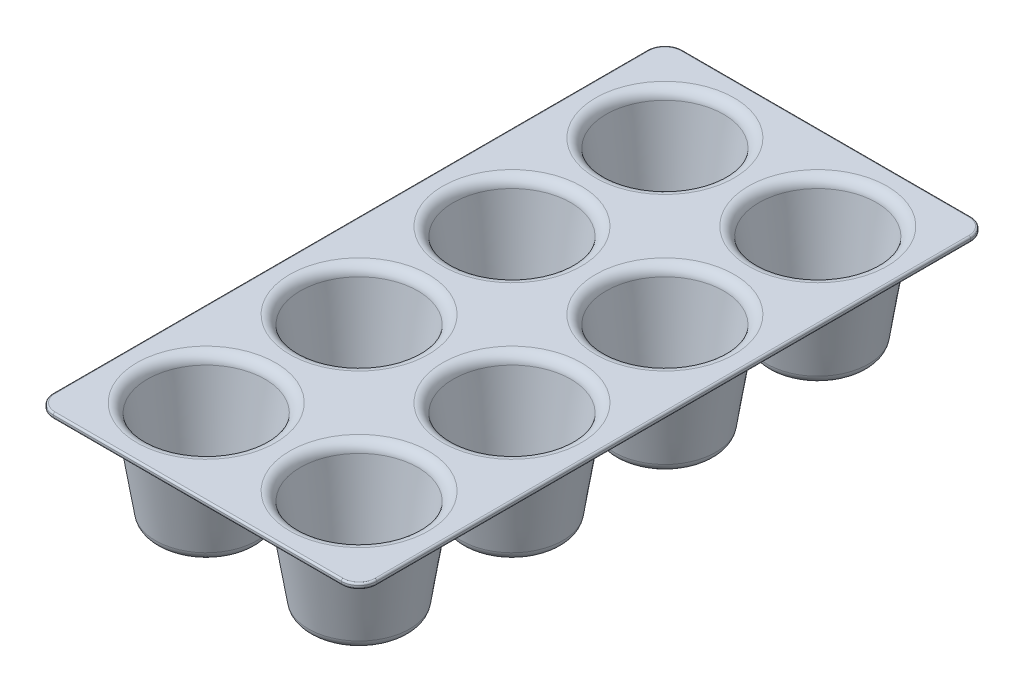
from build123d import *

# Parameters (mm, degrees)
LPATTERN5_COUNT     = 4
LPATTERN5_PITCH     = 86
LPATTERN6_COUNT     = 2
LPATTERN6_PITCH     = 86
SKETCH6_R           = 39
BOSS_EXTRUDE2_DEPTH = 3
FILLET1_R           = 1
FILLET2_R           = 1


with BuildPart() as part:
    # Sketch1 → Revolve1 (revolve)
    with BuildSketch(Plane.XY):
        with BuildLine():
            Line((0, -33.192951346), (-22.602129613, -33.192951346))
            ThreePointArc((-22.602129613, -33.192951346), (-26.498817903, -31.755387139), (-28.528259657, -28.131558136))
            Line((-28.528259657, -28.131558136), (-36.036934978, 19.276352049))
            ThreePointArc((-36.036934978, 19.276352049), (-37.051655855, 21.088266551), (-39, 21.807048654))
            Line((-39, 21.807048654), (-39, 24.807048654))
            ThreePointArc((-39, 24.807048654), (-35.10331171, 23.369484448), (-33.073869956, 19.745655445))
            Line((-33.073869956, 19.745655445), (-25.565194635, -27.662254741))
            ThreePointArc((-25.565194635, -27.662254741), (-24.550473758, -29.474169243), (-22.602129613, -30.192951346))
            Line((-22.602129613, -30.192951346), (0, -30.192951346))
            Line((0, -30.192951346), (0, -33.192951346))
        make_face()
    revolve(axis=Axis((0, 5.813808691, 0), (0, -1, 0)))


with BuildPart() as lpattern5_1:
    # LPattern5: pattern copy
    add(part.part.moved(Location(Vector(0, 0, 1) * (1 * LPATTERN5_PITCH))))


with BuildPart() as lpattern5_2:
    # LPattern5: pattern copy
    add(part.part.moved(Location(Vector(0, 0, 1) * (2 * LPATTERN5_PITCH))))


with BuildPart() as lpattern5_3:
    # LPattern5: pattern copy
    add(part.part.moved(Location(Vector(0, 0, 1) * (3 * LPATTERN5_PITCH))))


with BuildPart() as lpattern6_1:
    # LPattern6: pattern copy
    add(lpattern5_3.part.moved(Location(Vector(-1, 0, 0) * (1 * LPATTERN6_PITCH))))


with BuildPart() as lpattern6_2:
    # LPattern6: pattern copy
    add(lpattern5_2.part.moved(Location(Vector(-1, 0, 0) * (1 * LPATTERN6_PITCH))))


with BuildPart() as lpattern6_3:
    # LPattern6: pattern copy
    add(lpattern5_1.part.moved(Location(Vector(-1, 0, 0) * (1 * LPATTERN6_PITCH))))


with BuildPart() as lpattern6_4:
    # LPattern6: pattern copy
    add(part.part.moved(Location(Vector(-1, 0, 0) * (1 * LPATTERN6_PITCH))))


with BuildPart() as part_1:
    add(part.part)

    add(lpattern5_1.part)  # Boss-Extrude2 merges LPattern5_1

    add(lpattern5_2.part)  # Boss-Extrude2 merges LPattern5_2

    add(lpattern5_3.part)  # Boss-Extrude2 merges LPattern5_3

    add(lpattern6_1.part)  # Boss-Extrude2 merges LPattern6_1

    add(lpattern6_2.part)  # Boss-Extrude2 merges LPattern6_2

    add(lpattern6_3.part)  # Boss-Extrude2 merges LPattern6_3

    add(lpattern6_4.part)  # Boss-Extrude2 merges LPattern6_4
    # Sketch6 → Boss-Extrude2 (add)
    with BuildSketch(Plane(origin=(0, 24.807048654, 0), x_dir=(0, 0, -1), z_dir=(0, -1, 0))):
        with BuildLine():
            Line((38, 48), (-296, 48))
            ThreePointArc((-296, 48), (-303.071067812, 45.071067812), (-306, 38))
            Line((-306, 38), (-306, -124))
            ThreePointArc((-306, -124), (-303.071067812, -131.071067812), (-296, -134))
            Line((-296, -134), (38, -134))
            ThreePointArc((38, -134), (45.071067812, -131.071067812), (48, -124))
            Line((48, -124), (48, 38))
            ThreePointArc((48, 38), (45.071067812, 45.071067812), (38, 48))
        make_face()
        Circle(SKETCH6_R, mode=Mode.SUBTRACT)
        with Locations((-86, 0)):
            Circle(SKETCH6_R, mode=Mode.SUBTRACT)
        with Locations((-172, 0)):
            Circle(SKETCH6_R, mode=Mode.SUBTRACT)
        with Locations((-258, 0)):
            Circle(SKETCH6_R, mode=Mode.SUBTRACT)
        with Locations((-86, -86)):
            Circle(SKETCH6_R, mode=Mode.SUBTRACT)
        with Locations((-172, -86)):
            Circle(SKETCH6_R, mode=Mode.SUBTRACT)
        with Locations((-258, -86)):
            Circle(SKETCH6_R, mode=Mode.SUBTRACT)
        with Locations((0, -86)):
            Circle(SKETCH6_R, mode=Mode.SUBTRACT)
    extrude(amount=BOSS_EXTRUDE2_DEPTH)

    # Fillet1
    fillet1_edges = [part_1.edges().sort_by_distance(p)[0] for p in [
        (-131.071067812, 24.807048654, 303.071067812),
        (-134, 24.807048654, 129),
        (-131.071067812, 24.807048654, -45.071067812),
        (-43, 24.807048654, -48),
        (45.071067812, 24.807048654, -45.071067812),
        (48, 24.807048654, 129),
        (45.071067812, 24.807048654, 303.071067812),
        (-43, 24.807048654, 306),
    ]]
    fillet(fillet1_edges, radius=FILLET1_R)

    # Fillet2
    fillet2_edges = [part_1.edges().sort_by_distance(p)[0] for p in [
        (-131.071067812, 21.807048654, 303.071067812),
        (-134, 21.807048654, 129),
        (-131.071067812, 21.807048654, -45.071067812),
        (-43, 21.807048654, -48),
        (45.071067812, 21.807048654, -45.071067812),
        (48, 21.807048654, 129),
        (45.071067812, 21.807048654, 303.071067812),
        (-43, 21.807048654, 306),
    ]]
    fillet(fillet2_edges, radius=FILLET2_R)


solid = part_1.part
